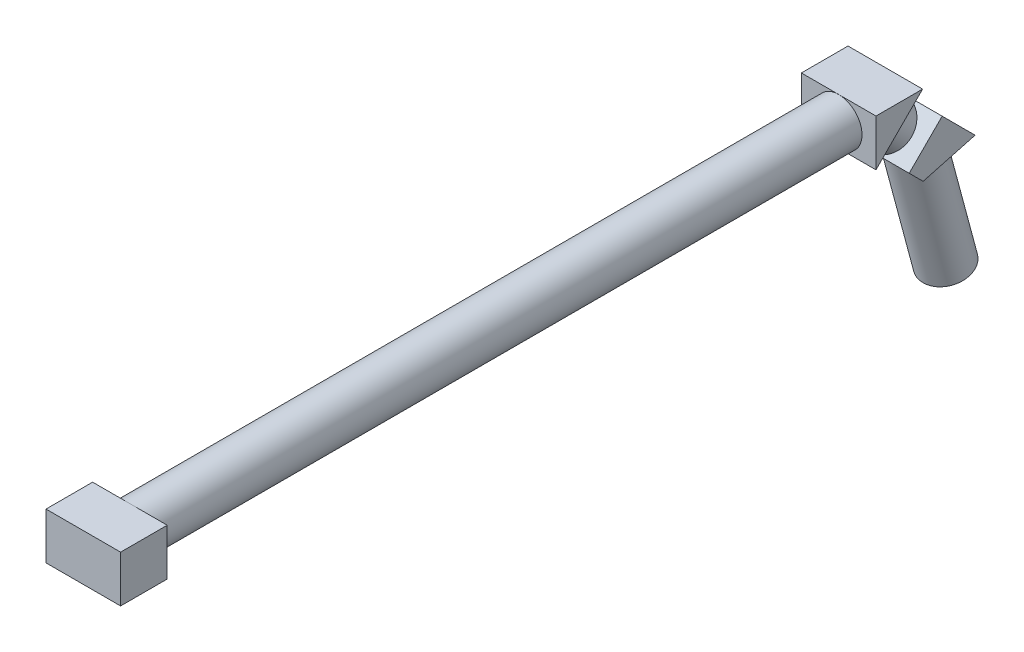
from build123d import *

# Parameters (mm, degrees)
ESQUISSE3_R                  = 12.5
BOSS_EXTRU_1_DEPTH           = 430
BOSS_EXTRU_2_DEPTH           = 20
BOSS_EXTRU_2_DEPTH_BACK      = 20
ESQUISSE4_W                  = 25
ESQUISSE4_H                  = 25
ENL_V_MAT_EXTRU_1_DEPTH      = 433.037324776
ENL_V_MAT_EXTRU_1_DEPTH_BACK = 433.037324776
ESQUISSE9_R                  = 12.5
BOSS_EXTRU_3_DEPTH           = 20
BOSS_EXTRU_4_DEPTH           = 40
ENL_V_MAT_EXTRU_2_DEPTH      = 434.766210072
ENL_V_MAT_EXTRU_2_DEPTH_BACK = 434.766210072
ESQUISSE12_R                 = 12.5
BOSS_EXTRU_5_DEPTH           = 70


with BuildPart() as part:
    # Esquisse3 → Boss.-Extru.1 (new body)
    with BuildSketch(Plane.XY):
        Circle(ESQUISSE3_R)
    extrude(amount=BOSS_EXTRU_1_DEPTH)

    # Esquisse4 → Boss.-Extru.2 (add, two sides: drawn at the far end of the back side and taken through both)
    with BuildSketch(Plane(origin=(0, 0, 0), x_dir=(0, 0, -1), z_dir=(1, 0, 0)).offset(-BOSS_EXTRU_2_DEPTH_BACK)):
        with Locations((-417.5, 0)):
            Rectangle(ESQUISSE4_W, ESQUISSE4_H)
        with Locations((-12.5, 0)):
            Rectangle(ESQUISSE4_W, ESQUISSE4_H)
    extrude(amount=BOSS_EXTRU_2_DEPTH + BOSS_EXTRU_2_DEPTH_BACK)

    # Esquisse8 → Enlèv. mat.-Extru.1 (cut, two sides: drawn at the far end of the back side and taken through both)
    with BuildSketch(Plane(origin=(20, 0, 0), x_dir=(0, 0, -1), z_dir=(1, 0, 0)).offset(-ENL_V_MAT_EXTRU_1_DEPTH_BACK)):
        Polygon((0, 12.5), (-25, -12.5), (0, -12.5), align=None)
    extrude(amount=ENL_V_MAT_EXTRU_1_DEPTH + ENL_V_MAT_EXTRU_1_DEPTH_BACK, mode=Mode.SUBTRACT)

    # Esquisse9 → Boss.-Extru.3 (add)
    with BuildSketch(Plane(origin=(0, 6.25, 6.25), x_dir=(-1, 0, 0), z_dir=(0, -0.7071067811865462, -0.707106781186549))):
        with Locations(Location((0, -8.838834765, 0), (0, 0, 270))):
            Circle(ESQUISSE9_R)
    extrude(amount=BOSS_EXTRU_3_DEPTH)

    # Esquisse10 → Boss.-Extru.4 (add)
    with BuildSketch(Plane(origin=(20, 0, 0), x_dir=(0, 0, -1), z_dir=(1, 0, 0))):
        Polygon((-7.196699141, -22.980970389), (10.480970389, -5.303300859), (28.158639918, -22.980970389), (10.480970389, -40.658639918), align=None)
    extrude(amount=-BOSS_EXTRU_4_DEPTH)

    # Esquisse11 → Enlèv. mat.-Extru.2 (cut, two sides: drawn at the far end of the back side and taken through both)
    with BuildSketch(Plane(origin=(20, 0, 0), x_dir=(0, 0, -1), z_dir=(1, 0, 0)).offset(-ENL_V_MAT_EXTRU_2_DEPTH_BACK)):
        Polygon((28.158639918, -22.980970389), (0.274763127, -30.452432657), (10.480970389, -40.658639918), align=None)
    extrude(amount=ENL_V_MAT_EXTRU_2_DEPTH + ENL_V_MAT_EXTRU_2_DEPTH_BACK, mode=Mode.SUBTRACT)

    # Esquisse12 → Boss.-Extru.5 (add)
    with BuildSketch(Plane(origin=(0, -28.481197254, -7.631513804), x_dir=(1, 0, 0), z_dir=(0, -0.9659258262890676, -0.2588190451025233))):
        with Locations(Location((0, -6.817487989, 0), (0, 0, 90))):
            Circle(ESQUISSE12_R)
    extrude(amount=BOSS_EXTRU_5_DEPTH)


solid = part.part
